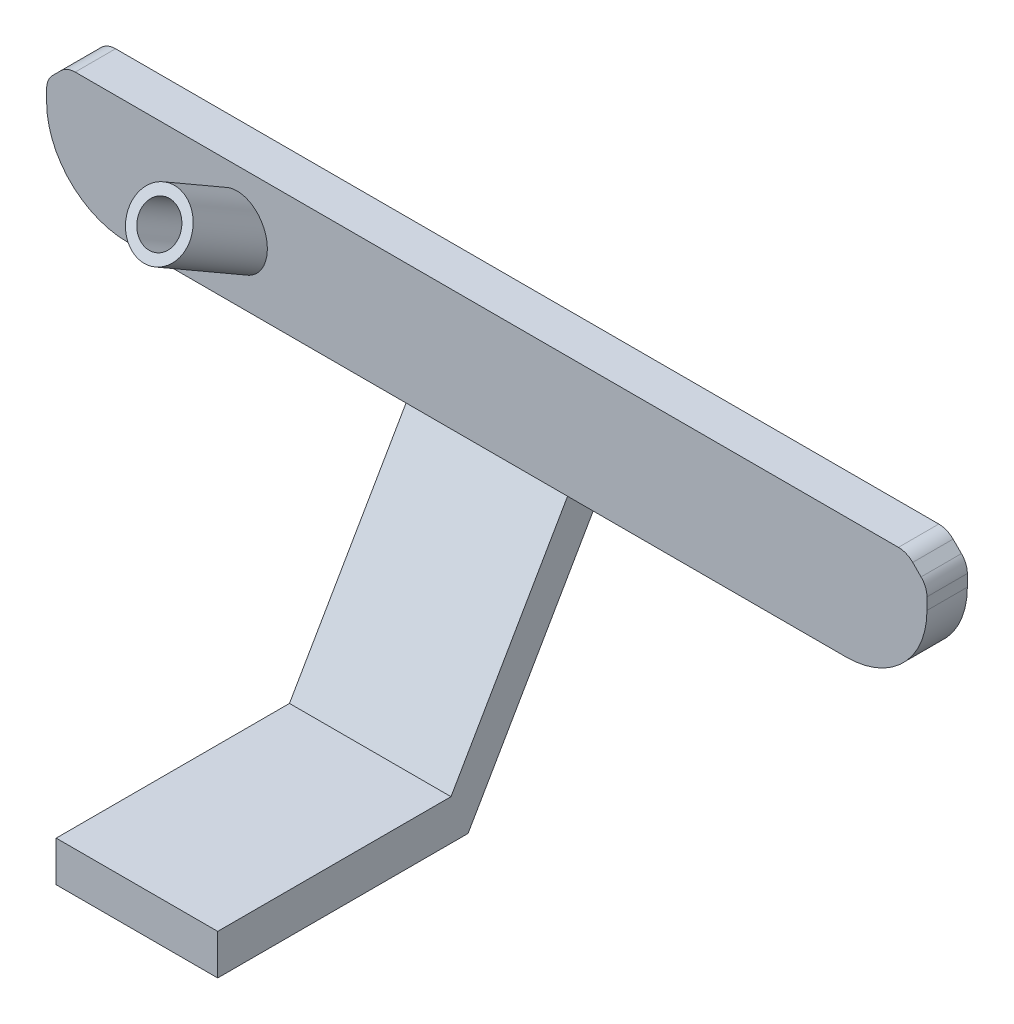
from build123d import *

# Parameters (mm, degrees)
SKETCH1_W           = 218
SKETCH1_H           = 30
BOSS_EXTRUDE1_DEPTH = 5
FILLET1_R           = 20
SKETCH4_R           = 5
CUT_EXTRUDE2_DEPTH  = 119.749210232
BOSS_EXTRUDE2_DEPTH = 20
CHAMFER2_SIZE       = 5
FILLET3_R           = 5


with BuildPart() as part:
    # Sketch1 → Boss-Extrude1 (new, symmetric)
    with BuildSketch(Plane.XY):
        Rectangle(SKETCH1_W, SKETCH1_H)
    extrude(amount=BOSS_EXTRUDE1_DEPTH, both=True)

    # Fillet1
    fillet1_edges = [part.edges().sort_by_distance(p)[0] for p in [
        (109, -15, 0),
        (-109, -15, 0),
    ]]
    fillet(fillet1_edges, radius=FILLET1_R)

    # Sketch3 → Revolve1 (revolve)
    with BuildSketch(Plane(origin=(-61.85, 0, 0), x_dir=(0, 0, -1), z_dir=(1, 0, 0)), mode=Mode.PRIVATE) as revolve1_sk:
        Polygon((-20.498711306, 18.495190528), (-24.248711306, 12), (10.392304845, -8), (14.142304845, -1.504809472), align=None)
    revolve(revolve1_sk.sketch.rotate(Axis((-61.85, 12, 24.248711306), (0, -0.49999999999999767, -0.86602540378444)), 180), axis=Axis((-61.85, 12, 24.248711306), (0, -0.49999999999999767, -0.86602540378444)))

    # Sketch4 → Cut-Extrude2 (cut, through all)
    with BuildSketch(Plane(origin=(0, 13.5, 23.382685902), x_dir=(1, 0, 0), z_dir=(0, 0.4999999999999978, 0.86602540378444))):
        with Locations(Location((-61.85, -1.732050808, 0), (0, 0, 270))):
            Circle(SKETCH4_R)
    extrude(amount=-CUT_EXTRUDE2_DEPTH, mode=Mode.SUBTRACT)

    # Sketch5 → Boss-Extrude2 (add, symmetric)
    with BuildSketch(Plane(origin=(0, 0, 0), x_dir=(0, 0, -1), z_dir=(1, 0, 0))):
        Polygon((5, -15), (-5, -15), (-33.867513459, -65), (-91.641016151, -65), (-91.641016151, -75), (-29.641016151, -75), align=None)
    extrude(amount=BOSS_EXTRUDE2_DEPTH, both=True)

    # Chamfer2
    chamfer2_edges = [part.edges().sort_by_distance(p)[0] for p in [
        (-109, 15, 0),
        (109, 15, 0),
    ]]
    chamfer(chamfer2_edges, length=CHAMFER2_SIZE)

    # Fillet3
    fillet3_edges = [part.edges().sort_by_distance(p)[0] for p in [
        (-109, 10, 0),
        (104, 15, 0),
        (-104, 15, 0),
        (109, 10, 0),
    ]]
    fillet(fillet3_edges, radius=FILLET3_R)


solid = part.part
